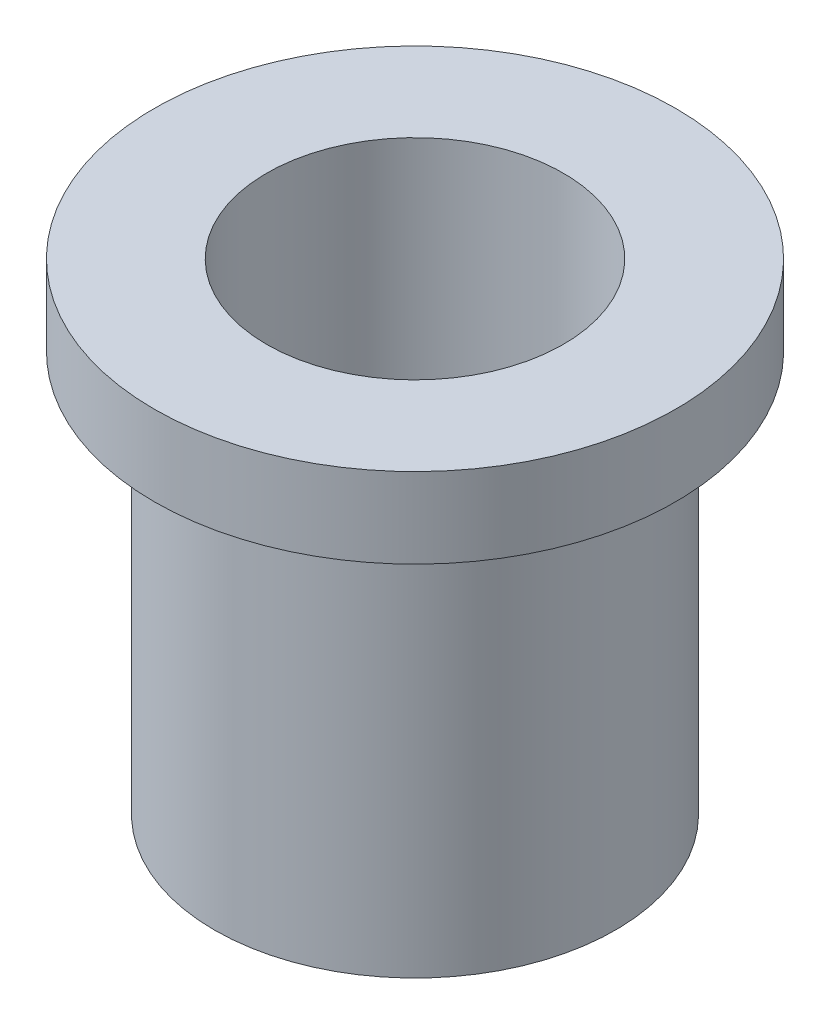
from build123d import *

# Parameters (mm, degrees)
SKETCH2_R           = 3.175
SKETCH2_R_2         = 2.3495
BOSS_EXTRUDE1_DEPTH = 6.35
SKETCH3_R           = 4.1275
SKETCH3_R_2         = 2.3495
BOSS_EXTRUDE2_DEPTH = 1.27


with BuildPart() as part:
    # Sketch2 → Boss-Extrude1 (new body)
    with BuildSketch(Plane(origin=(0, 0, 0), x_dir=(1, 0, 0), z_dir=(0, 1, 0))):
        with Locations(Location((0, 0, 0), (0, 0, 270))):
            Circle(SKETCH2_R)
        with Locations(Location((0, 0, 0), (0, 0, 270))):
            Circle(SKETCH2_R_2, mode=Mode.SUBTRACT)
    extrude(amount=BOSS_EXTRUDE1_DEPTH)

    # Sketch3 → Boss-Extrude2 (add)
    with BuildSketch(Plane(origin=(0, 6.35, 0), x_dir=(1, 0, 0), z_dir=(0, 1, 0))):
        with Locations(Location((0, 0, 0), (0, 0, 270))):
            Circle(SKETCH3_R)
        with Locations(Location((0, 0, 0), (0, 0, 270))):
            Circle(SKETCH3_R_2, mode=Mode.SUBTRACT)
    extrude(amount=BOSS_EXTRUDE2_DEPTH)


solid = part.part
